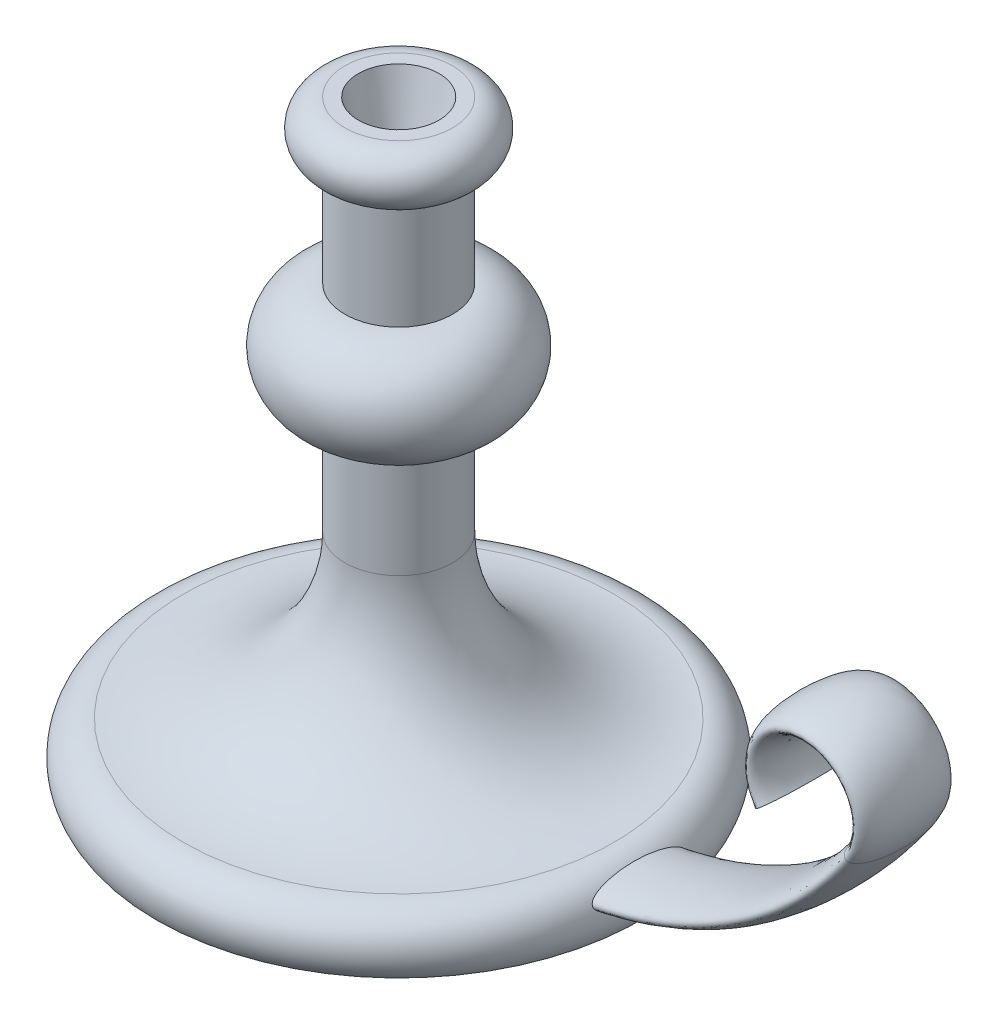
from build123d import *

# Parameters (mm, degrees)
SKETCH_3_RX         = 17.5
SKETCH_3_RY         = 5
SKETCH_4_R          = 15
CUT_EXTRUDE_1_DEPTH = 25
CUT_EXTRUDE_1_DRAFT = -15


with BuildPart() as part:
    # Эскиз1 → Повернуть1 (revolve)
    with BuildSketch(Plane.XY, mode=Mode.PRIVATE) as revolve_1_sk:
        with BuildLine():
            Line((0, 0), (0, 220))
            Line((0, 220), (20, 220))
            ThreePointArc((20, 220), (30, 210), (20, 200))
            Line((20, 200), (20, 160))
            ThreePointArc((20, 160), (40, 140), (20, 120))
            Line((20, 120), (20, 80))
            ThreePointArc((20, 80), (37.573593129, 37.573593129), (80, 20))
            ThreePointArc((80, 20), (91.180339887, 13.090169944), (90, 0))
            Line((90, 0), (0, 0))
        make_face()
    revolve(revolve_1_sk.sketch.rotate(Axis((0, 0, 0), (0, 1, 0)), 90), axis=Axis((0, 0, 0), (0, 1, 0)))

    # По траектории1: sweep along a path in Эскиз2
    with BuildLine(Plane.XY) as sweep_1_path:
        Line((0, 10), (60, 10))
        ThreePointArc((60, 10), (129.821200219, 27.240819526), (183.592070943, 75))
        ThreePointArc((183.592070943, 75), (167.113128151, 106.333333333), (150.634185358, 75))
    # Эскиз3 → По траектории1 (sweep)
    with BuildSketch(Plane(origin=(0, 0, 0), x_dir=(0, 0, -1), z_dir=(1, 0, 0))):
        with Locations((0, 10)):
            Ellipse(SKETCH_3_RX, SKETCH_3_RY)
    sweep(path=sweep_1_path.line)


with BuildPart() as cut_extrude_1_tool:
    # Эскиз4 → Вырез-Вытянуть1 (with draft: the straight prism first)
    with BuildSketch(Plane(origin=(0, 220, 0), x_dir=(1, 0, 0), z_dir=(0, 1, 0))):
        Circle(SKETCH_4_R)
    extrude(amount=-CUT_EXTRUDE_1_DEPTH)
    # Вырез-Вытянуть1: the draft: its side faces are tilted about the plane it starts from
    cut_extrude_1_sides = [cut_extrude_1_tool.faces().sort_by_distance(p)[0] for p in [
        (-15, 207.5, 0),
    ]]
    draft(cut_extrude_1_sides, Plane(origin=(0, 220, 0), x_dir=(1, 0, 0), z_dir=(0, 1, 0)), CUT_EXTRUDE_1_DRAFT)


with BuildPart() as part_1:
    add(part.part)

    # Вырез-Вытянуть1: cut by cut_extrude_1_tool
    add(cut_extrude_1_tool.part, mode=Mode.SUBTRACT)


solid = part_1.part
